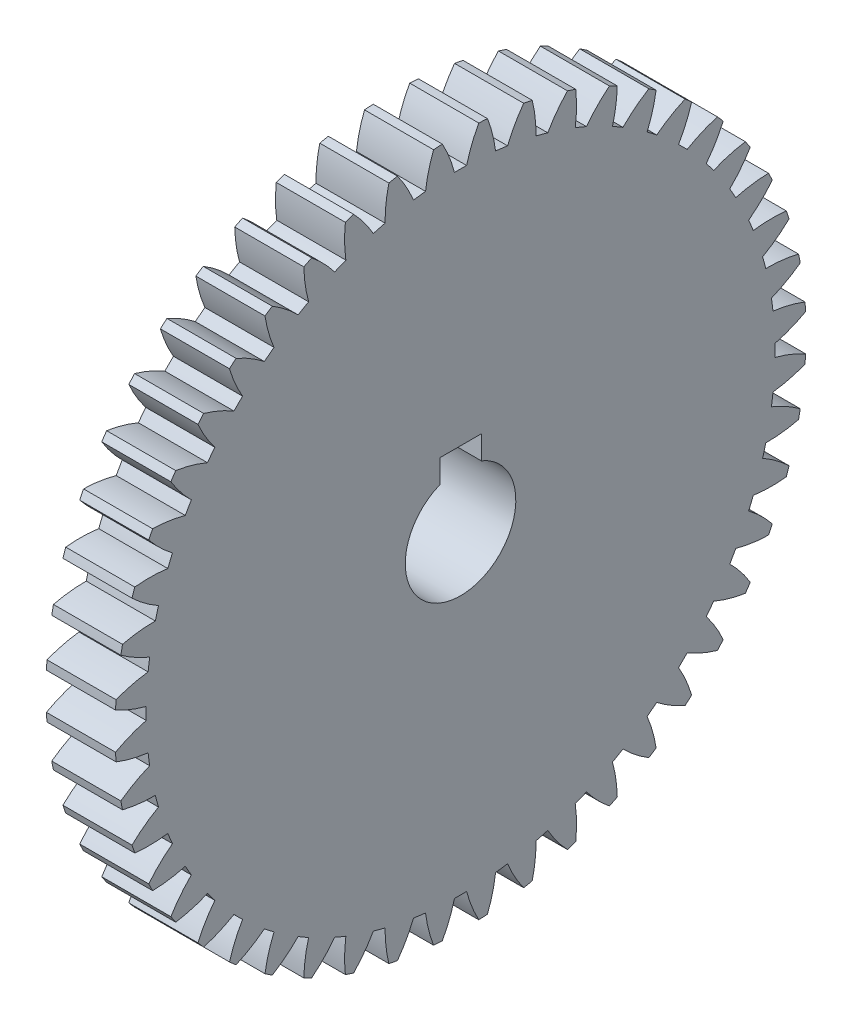
from build123d import *

# Parameters (mm, degrees)
BASPROSKE_W      = 5
BASPROSKE_H      = 25
TOOTHCUT_DEPTH   = 36.707142143
TEETHCUTS_COUNT  = 48
TEETHCUTS_ANGLE  = 352.5
HUBNEAONESKE_R   = 5
HUBNEARONE_DEPTH = 5.0000508
BORSKE_R         = 4
BORE_DEPTH       = 10.0000508
KEYSKE_W         = 3
KEYSKE_H         = 5.4
KEYWAY_DEPTH     = 10.0000508


with BuildPart() as part:
    # BasProSke → Base-Revolve (revolve)
    with BuildSketch(Plane(origin=(0, 0, 0), x_dir=(1, 0, 0), z_dir=(0, 1, 0)), mode=Mode.PRIVATE) as base_revolve_sk:
        with Locations((2.5, 12.5)):
            Rectangle(BASPROSKE_W, BASPROSKE_H)
    revolve(base_revolve_sk.sketch.rotate(Axis((-10, 0, 0), (1, 0, 0)), 180), axis=Axis((-10, 0, 0), (1, 0, 0)))

    # TooCutSke → ToothCut (cut, through all)
    with BuildSketch(Plane(origin=(0, 0, 0), x_dir=(0, 0, -1), z_dir=(1, 0, 0))):
        with BuildLine():
            ThreePointArc((0.439519311, 22.744753764), (0, 22.749), (-0.439519311, 22.744753764))
            ThreePointArc((-0.439519311, 22.744753764), (-0.815652087, 23.895542925), (-1.33363602, 24.989839138))
            ThreePointArc((-1.33363602, 24.989839138), (0, 25.0254), (1.33363602, 24.989839138))
            ThreePointArc((1.33363602, 24.989839138), (0.815652087, 23.895542925), (0.439519311, 22.744753764))
        make_face()
    toothcut = extrude(amount=TOOTHCUT_DEPTH, mode=Mode.SUBTRACT)

    # TeethCuts: ToothCut ×48 about axis
    teethcuts_axis = Axis((-10, 0, 0), (1, 0, 0))
    for i in range(1, TEETHCUTS_COUNT):
        add(toothcut.rotate(teethcuts_axis, i * TEETHCUTS_ANGLE / (TEETHCUTS_COUNT - 1)), mode=Mode.SUBTRACT)

    # HubNeaOneSke → HubNearOne (add)
    with BuildSketch(Plane.ZY):
        with Locations(Location((0, 0, 0), (0, 0, 180))):
            Circle(HUBNEAONESKE_R)
    extrude(amount=HUBNEARONE_DEPTH)

    # BorSke → Bore (cut, symmetric)
    with BuildSketch(Plane(origin=(0, 0, 0), x_dir=(0, 0, -1), z_dir=(1, 0, 0))):
        with Locations(Location((0, 0, 0), (0, 0, 180))):
            Circle(BORSKE_R)
    extrude(amount=BORE_DEPTH, both=True, mode=Mode.SUBTRACT)

    # KeySke → Keyway (cut, symmetric)
    with BuildSketch(Plane(origin=(0, 0, 0), x_dir=(0, 0, -1), z_dir=(1, 0, 0))):
        with Locations((0, 2.7)):
            Rectangle(KEYSKE_W, KEYSKE_H)
    extrude(amount=KEYWAY_DEPTH, both=True, mode=Mode.SUBTRACT)


solid = part.part
